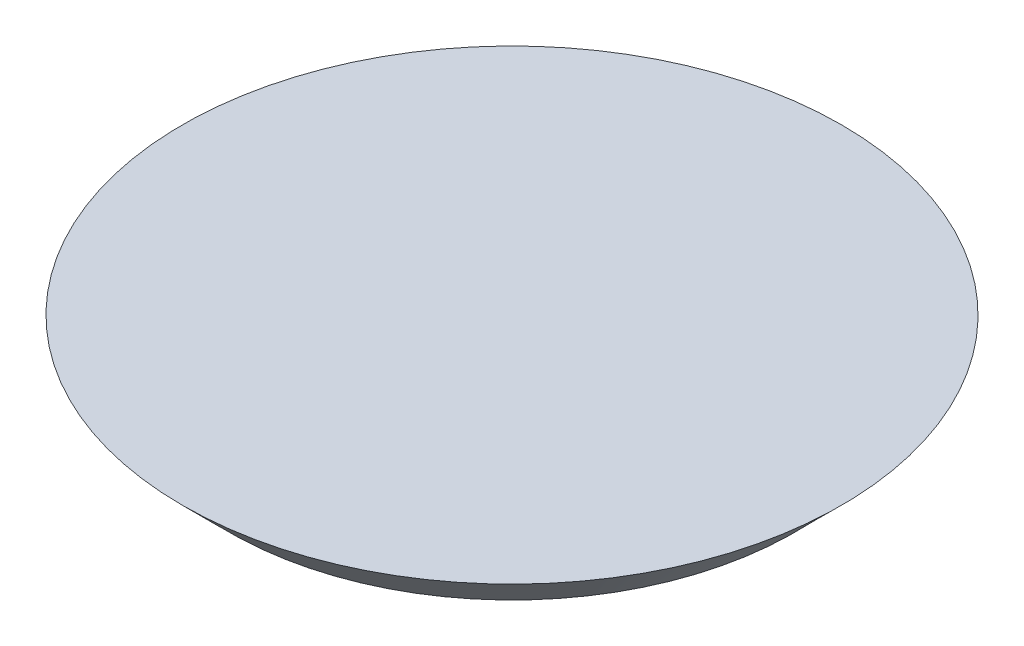
from build123d import *


with BuildPart() as part:
    # Sketch1 → Foot Revolve (revolve)
    with BuildSketch(Plane.XY, mode=Mode.PRIVATE) as foot_revolve_sk:
        Polygon((0, 2.938967136), (7, 2.938967136), (6, 1.938967136), (0, 1.938967136), align=None)
    revolve(foot_revolve_sk.sketch.rotate(Axis((0, -6.474178404, 0), (0, 1, 0)), 90), axis=Axis((0, -6.474178404, 0), (0, 1, 0)))


solid = part.part
